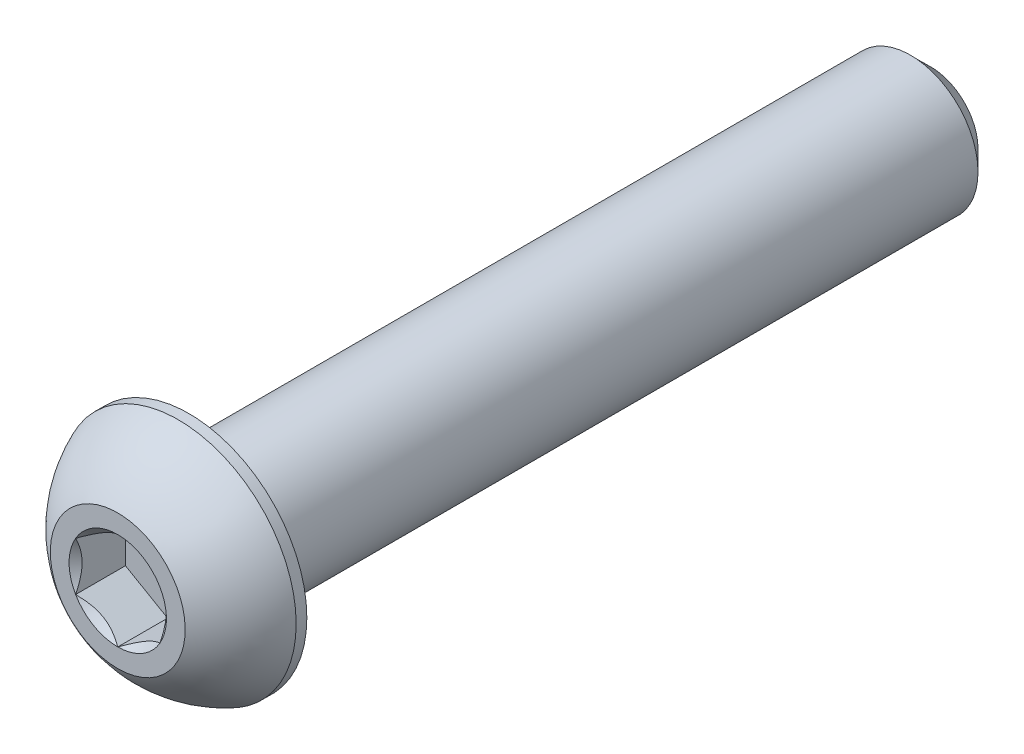
from build123d import *

# Parameters (mm, degrees)
SKETCH1_W          = 34.925
SKETCH1_H          = 3.175
CHAMFER1_SIZE      = 0.9525
CUT_EXTRUDE2_DEPTH = 2.34696


with BuildPart() as part:
    # Sketch1 → Revolve1 (revolve)
    with BuildSketch(Plane(origin=(0, 0, 0), x_dir=(0, 0, -1), z_dir=(1, 0, 0))):
        with Locations((20.8153, 1.5875)):
            Rectangle(SKETCH1_W, SKETCH1_H)
    revolve(axis=Axis((0, 0, -38.2778), (0, 0, 1)))

    # Chamfer1
    chamfer1_edges = [part.edges().sort_by_distance(p)[0] for p in [
        (0, -3.175, -38.2778),
    ]]
    chamfer(chamfer1_edges, length=CHAMFER1_SIZE)

    # Sketch7 → Revolve2 (revolve)
    with BuildSketch(Plane(origin=(0, 0, 0), x_dir=(0, 0, -1), z_dir=(1, 0, 0))):
        with BuildLine():
            Line((2.84988, 5.5499), (3.3528, 5.5499))
            Line((3.3528, 5.5499), (3.3528, 0))
            Line((3.3528, 0), (0, 0))
            Line((0, 0), (0, 3.175))
            ThreePointArc((0, 3.175), (1.235921075, 4.58927271), (2.84988, 5.5499))
        make_face()
    revolve(axis=Axis((0, 0, 0), (0, 0, -1)))

    # Sketch5 → Cut-Extrude2 (cut)
    with BuildSketch(Plane.XY):
        Polygon((1.984375, -1.14567944), (1.984375, 1.14567944), (0, 2.291358881), (-1.984375, 1.14567944), (-1.984375, -1.14567944), (0, -2.291358881), align=None)
    extrude(amount=-CUT_EXTRUDE2_DEPTH, mode=Mode.SUBTRACT)

    # Cut-Extrude3 cone 1 section (through the dimple's axis) → Cut-Extrude3 (revolve, cut)
    with BuildSketch(Plane(origin=(0, 0, 0), x_dir=(0, -1, 0), z_dir=(1, 0, 0))):
        Polygon((0, 0), (2.291358881, 0), (0, 2.291358881), align=None)
    revolve(axis=Axis((0, 0, 0), (0, 0, -1)), mode=Mode.SUBTRACT)


solid = part.part
